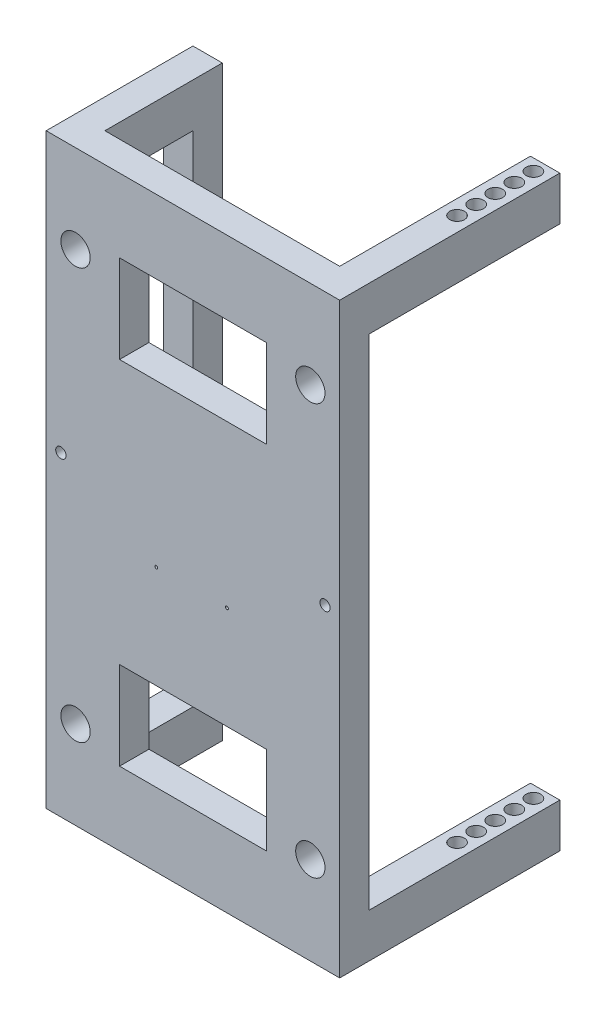
from build123d import *

# Parameters (mm, degrees)
BOSS_EXTRUDE1_DEPTH = 400
SKETCH3_W           = 100
SKETCH3_H           = 300
CUT_EXTRUDE1_DEPTH  = 400
SKETCH4_W           = 60
SKETCH4_H           = 340
CUT_EXTRUDE2_DEPTH  = 400
SKETCH5_W           = 70
SKETCH5_H           = 340
CUT_EXTRUDE4_DEPTH  = 118
SKETCH6_R           = 5
CUT_EXTRUDE5_DEPTH  = 543
SKETCH7_R           = 5
CUT_EXTRUDE6_DEPTH  = 193
SKETCH8_R           = 10
CUT_EXTRUDE7_DEPTH  = 20
SKETCH9_W           = 100
SKETCH9_H           = 180
BOSS_EXTRUDE2_DEPTH = 20
SKETCH11_R          = 1
CUT_EXTRUDE8_DEPTH  = 26.5
SKETCH12_R          = 3.5
CUT_EXTRUDE9_DEPTH  = 35


with BuildPart() as part:
    # Sketch2 → Boss-Extrude1 (new body)
    with BuildSketch(Plane(origin=(0, 0, 0), x_dir=(1, 0, 0), z_dir=(0, 1, 0))):
        Polygon((0, 0), (0, 100), (20, 100), (20, 20), (180, 20), (180, 150), (200, 150), (200, 0), align=None)
    extrude(amount=-BOSS_EXTRUDE1_DEPTH)

    # Sketch3 → Cut-Extrude1 (cut)
    with BuildSketch(Plane.XY):
        with Locations((100, -200)):
            Rectangle(SKETCH3_W, SKETCH3_H)
    extrude(amount=-CUT_EXTRUDE1_DEPTH, mode=Mode.SUBTRACT)

    # Sketch4 → Cut-Extrude2 (cut)
    with BuildSketch(Plane.ZY):
        with Locations((-50, -200)):
            Rectangle(SKETCH4_W, SKETCH4_H)
    extrude(amount=-CUT_EXTRUDE2_DEPTH, mode=Mode.SUBTRACT)

    # Sketch5 → Cut-Extrude4 (cut)
    with BuildSketch(Plane(origin=(200, 0, 0), x_dir=(0, 0, -1), z_dir=(1, 0, 0))):
        with Locations((115, -200)):
            Rectangle(SKETCH5_W, SKETCH5_H)
    extrude(amount=-CUT_EXTRUDE4_DEPTH, mode=Mode.SUBTRACT)

    # Sketch6 → Cut-Extrude5 (cut)
    with BuildSketch(Plane(origin=(0, 0, 0), x_dir=(1, 0, 0), z_dir=(0, 1, 0))):
        with Locations(Location((190, 142, 0), (0, 0, 90))):
            Circle(SKETCH6_R)
        with Locations(Location((190, 129, 0), (0, 0, 90))):
            Circle(SKETCH6_R)
        with Locations(Location((190, 116, 0), (0, 0, 90))):
            Circle(SKETCH6_R)
        with Locations(Location((190, 103, 0), (0, 0, 90))):
            Circle(SKETCH6_R)
        with Locations(Location((190, 90, 0), (0, 0, 90))):
            Circle(SKETCH6_R)
    extrude(amount=-CUT_EXTRUDE5_DEPTH, mode=Mode.SUBTRACT)

    # Sketch7 → Cut-Extrude6 (cut)
    with BuildSketch(Plane.ZY):
        with Locations((-90, -80)):
            Circle(SKETCH7_R)
        with Locations((-90, -320)):
            Circle(SKETCH7_R)
    extrude(amount=-CUT_EXTRUDE6_DEPTH, mode=Mode.SUBTRACT)

    # Sketch8 → Cut-Extrude7 (cut)
    with BuildSketch(Plane.XY):
        with Locations((180, -60)):
            Circle(SKETCH8_R)
        with Locations((20, -60)):
            Circle(SKETCH8_R)
        with Locations((180, -340)):
            Circle(SKETCH8_R)
        with Locations((20, -340)):
            Circle(SKETCH8_R)
    extrude(amount=-CUT_EXTRUDE7_DEPTH, mode=Mode.SUBTRACT)

    # Sketch9 → Boss-Extrude2 (add)
    with BuildSketch(Plane.XY):
        with Locations((100, -200)):
            Rectangle(SKETCH9_W, SKETCH9_H)
    extrude(amount=-BOSS_EXTRUDE2_DEPTH)

    # Sketch11 → Cut-Extrude8 (cut, symmetric)
    with BuildSketch(Plane.XY):
        with Locations((75, -220)):
            Circle(SKETCH11_R)
        with Locations((123.17, -220)):
            Circle(SKETCH11_R)
    extrude(amount=CUT_EXTRUDE8_DEPTH, both=True, mode=Mode.SUBTRACT)

    # Sketch12 → Cut-Extrude9 (cut)
    with BuildSketch(Plane.XY):
        with Locations((190, -185)):
            Circle(SKETCH12_R)
    cut_extrude9 = extrude(amount=-CUT_EXTRUDE9_DEPTH, mode=Mode.SUBTRACT)

    # Mirror1: Cut-Extrude9 across plane
    add(cut_extrude9.mirror(Plane(origin=(100, 0, 0), x_dir=(0, 0, 1), z_dir=(1, 0, 0))), mode=Mode.SUBTRACT)


solid = part.part
